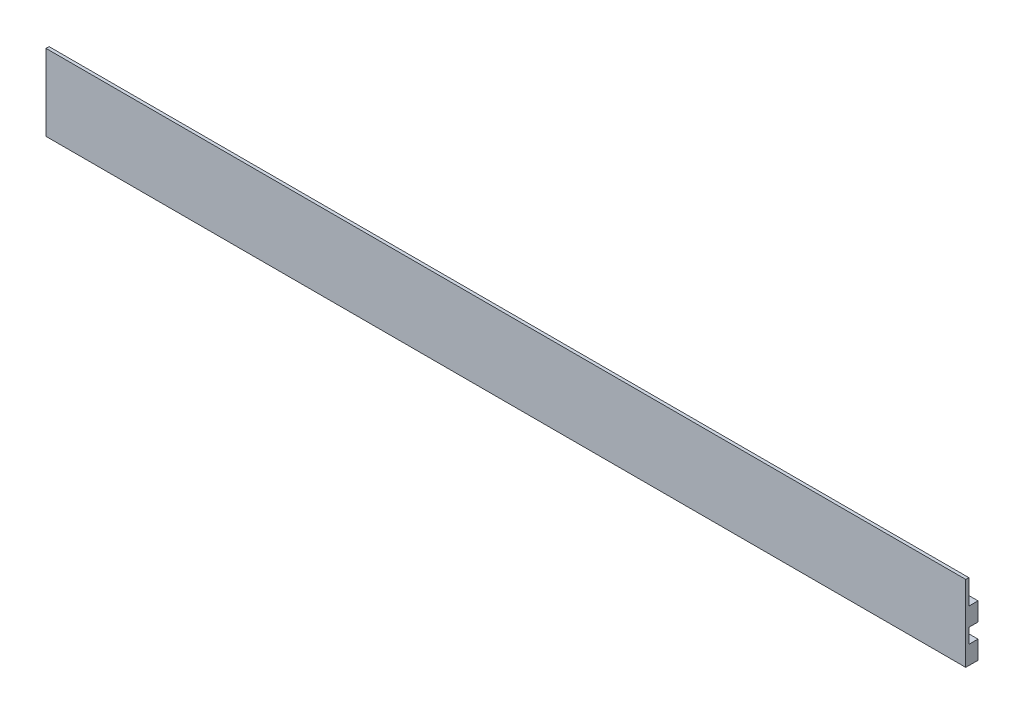
from build123d import *

# Parameters (mm, degrees)
SKETCH1_W           = 3000
SKETCH1_H           = 1100
BOSS_EXTRUDE1_DEPTH = 5
SKETCH3_W           = 3000
SKETCH3_H           = 60
BOSS_EXTRUDE3_DEPTH = 30
SKETCH4_W           = 3000
SKETCH4_H           = 851.346620116
CUT_EXTRUDE1_DEPTH  = 1598.936168938


with BuildPart() as part:
    # Sketch1 → Boss-Extrude1 (new, symmetric)
    with BuildSketch(Plane.XY):
        Rectangle(SKETCH1_W, SKETCH1_H)
    extrude(amount=BOSS_EXTRUDE1_DEPTH, both=True)

    # Sketch3 → Boss-Extrude3 (add)
    with BuildSketch(Plane(origin=(0, 0, -5), x_dir=(-1, 0, 0), z_dir=(0, 0, -1))):
        with Locations((0, 439.471551707)):
            Rectangle(SKETCH3_W, SKETCH3_H)
        with Locations((0, 331.346620116)):
            Rectangle(SKETCH3_W, SKETCH3_H)
    extrude(amount=BOSS_EXTRUDE3_DEPTH)

    # Sketch4 → Cut-Extrude1 (cut, through all)
    with BuildSketch(Plane(origin=(0, 0, -5), x_dir=(-1, 0, 0), z_dir=(0, 0, -1))):
        with Locations((0, -124.326689942)):
            Rectangle(SKETCH4_W, SKETCH4_H)
    extrude(amount=-CUT_EXTRUDE1_DEPTH, mode=Mode.SUBTRACT)


solid = part.part
